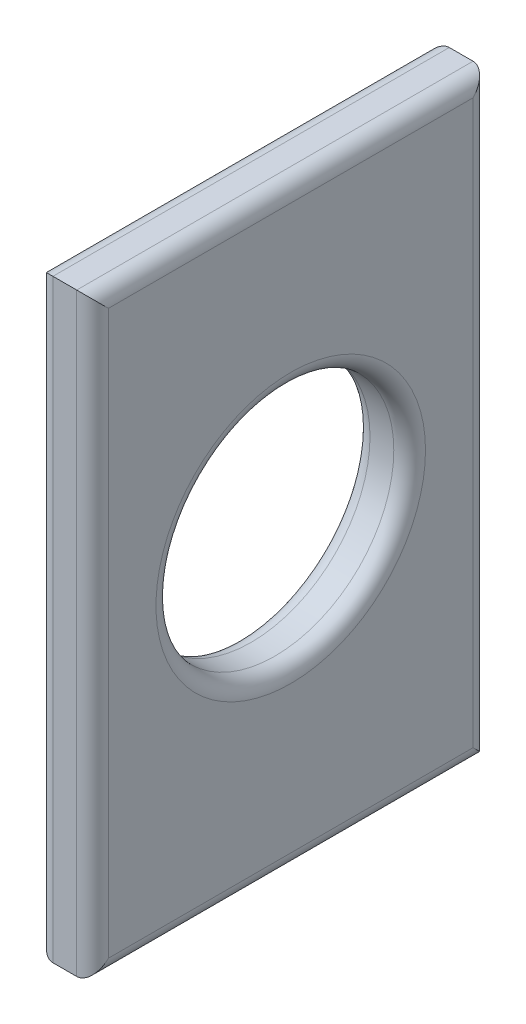
from build123d import *

# Parameters (mm, degrees)
SKETCH1_W           = 12.7
SKETCH1_H           = 19.05
SKETCH1_R           = 3.81
BOSS_EXTRUDE1_DEPTH = 1.778
FILLET1_R           = 0.508


with BuildPart() as part:
    # Sketch1 → Boss-Extrude1 (new body)
    with BuildSketch(Plane(origin=(0, 0, 0), x_dir=(0, 0, -1), z_dir=(1, 0, 0))):
        Rectangle(SKETCH1_W, SKETCH1_H)
        Circle(SKETCH1_R, mode=Mode.SUBTRACT)
    extrude(amount=BOSS_EXTRUDE1_DEPTH)

    # Fillet1
    fillet1_edges = [part.edges().sort_by_distance(p)[0] for p in [
        (0, 0, 3.81),
        (1.778, 0, 3.81),
        (1.778, 0, 6.35),
        (1.778, -9.525, 0),
        (1.778, 0, -6.35),
        (0, -9.525, 0),
        (0, 0, 6.35),
        (0, 9.525, 0),
        (0, 0, -6.35),
        (1.778, 9.525, 0),
    ]]
    fillet(fillet1_edges, radius=FILLET1_R)


solid = part.part
